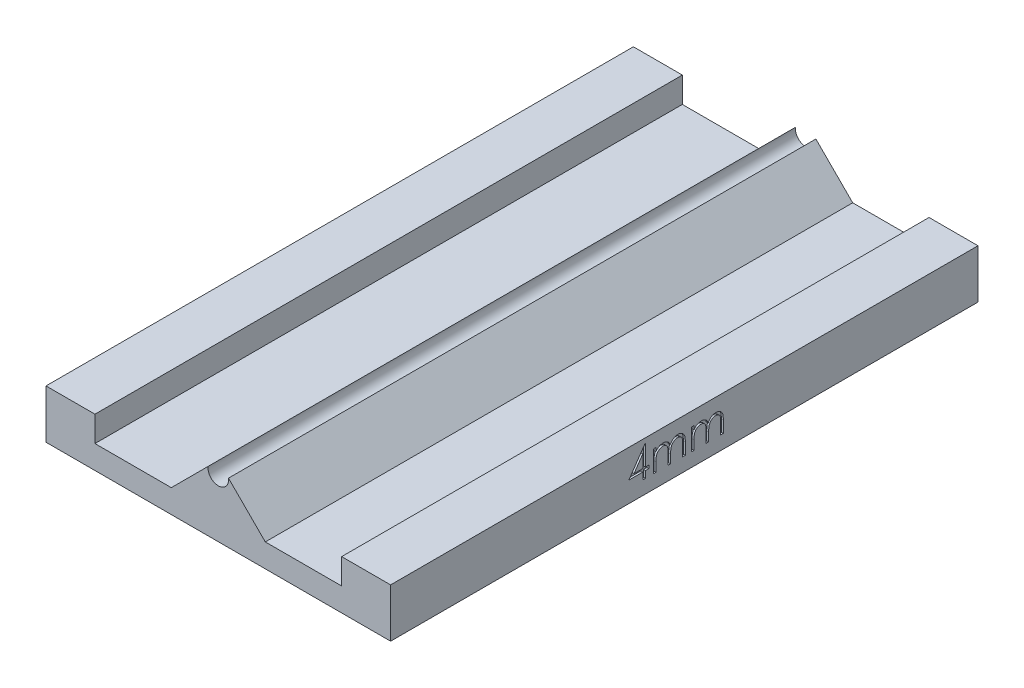
from build123d import *

# Parameters (mm, degrees)
BOSS_EXTRUDE1_DEPTH = 120
CUT_EXTRUDE1_DEPTH  = 0.4


with BuildPart() as part:
    # Sketch1 → Boss-Extrude1 (new body)
    with BuildSketch(Plane.XY):
        with BuildLine():
            ThreePointArc((2.1, 0), (-0.147755484, -2.094795531), (-2.079207921, 0.294778598))
            Line((-2.079207921, 0.294778598), (-9.604138038, -7.230151519))
            Line((-9.604138038, -7.230151519), (-25.2, -7.230151519))
            Line((-25.2, -7.230151519), (-25.2, -2.030151519))
            Line((-25.2, -2.030151519), (-35.2, -2.030151519))
            Line((-35.2, -2.030151519), (-35.2, -12))
            Line((-35.2, -12), (35.2, -12))
            Line((35.2, -12), (35.2, -2.030151519))
            Line((35.2, -2.030151519), (25.2, -2.030151519))
            Line((25.2, -2.030151519), (25.2, -7.230151519))
            Line((25.2, -7.230151519), (9.604138038, -7.230151519))
            Line((9.604138038, -7.230151519), (2.079207921, 0.294778598))
            ThreePointArc((2.079207921, 0.294778598), (2.094795531, 0.147755484), (2.1, 0))
        make_face()
    extrude(amount=BOSS_EXTRUDE1_DEPTH)

    # Sketch2 → Cut-Extrude1 (cut)
    # profile 1 of 3: a face of its own
    with BuildSketch(Plane(origin=(35.2, 0, 0), x_dir=(0, 0, -1), z_dir=(1, 0, 0))):
        Polygon((-68.056401288, -3.06394384), (-67.947026288, -3.06394384), (-67.947026288, -7.217789993), (-67.254718595, -7.217789993), (-67.254718595, -7.833174609), (-67.947026288, -7.833174609), (-67.947026288, -9.217789993), (-68.485487826, -9.217789993), (-68.485487826, -7.833174609), (-71.331641672, -7.833174609), align=None)
        Polygon((-68.485487826, -7.217789993), (-68.485487826, -4.614424609), (-70.272747441, -7.217789993), align=None, mode=Mode.SUBTRACT)
    # profile 2 of 3: a face of its own
    with BuildSketch(Plane(origin=(35.2, 0, 0), x_dir=(0, 0, -1), z_dir=(1, 0, 0))):
        with BuildLine():
            Line((-66.331641672, -4.833174609), (-65.793180134, -4.833174609))
            Line((-65.793180134, -4.833174609), (-65.793180134, -5.59519384))
            add(Edge.make_bspline(
                [(-65.793180134, -5.59519384), (-65.744693362, -5.528529379), (-65.65178806, -5.400793883), (-65.499446942, -5.232467681), (-65.34725932, -5.089619416), (-65.237659237, -5.014631636), (-65.185007057, -4.978607301)],
                knots=[0, 0, 0, 0, 1.134379233, 2.173579362, 3.122582517, 4, 4, 4, 4], degree=3))
            add(Edge.make_bspline(
                [(-65.185007057, -4.978607301), (-65.113239064, -4.944312389), (-64.970956951, -4.876321738), (-64.745666851, -4.807349922), (-64.515138846, -4.764964034), (-64.359467622, -4.759167394), (-64.281160903, -4.756251532)],
                knots=[0, 0, 0, 0, 1.014936303, 2.012140481, 3.000054389, 4, 4, 4, 4], degree=3))
            add(Edge.make_bspline(
                [(-64.281160903, -4.756251532), (-64.22820148, -4.758043459), (-64.12339763, -4.761589586), (-63.968110619, -4.784663932), (-63.817495856, -4.8245488), (-63.672443234, -4.880104213), (-63.535779212, -4.947384247), (-63.410483445, -5.026326604), (-63.297984802, -5.114950162), (-63.198340143, -5.217256904), (-63.108736099, -5.336119644), (-63.026315219, -5.474744071), (-62.950157712, -5.636242919), (-62.907949754, -5.753442703), (-62.885728211, -5.815145763)],
                knots=[0, 0, 0, 0, 1.009824226, 1.998387844, 2.986035974, 3.974953746, 4.955485308, 5.885931332, 6.793869504, 7.679848016, 8.601185859, 9.625726857, 10.749998409, 12, 12, 12, 12], degree=3))
            add(Edge.make_bspline(
                [(-62.885728211, -5.815145763), (-62.862223208, -5.772761044), (-62.815968665, -5.68935387), (-62.738301858, -5.571311134), (-62.656928493, -5.460899491), (-62.571155076, -5.358031335), (-62.481284356, -5.263214654), (-62.386893384, -5.176135966), (-62.288519473, -5.096421314), (-62.151732776, -5.003295898), (-61.973768306, -4.904379587), (-61.749388681, -4.81861654), (-61.515988387, -4.765617463), (-61.357558047, -4.759394138), (-61.277555134, -4.756251532)],
                knots=[0, 0, 0, 0, 0.86119277, 1.694706429, 2.50939023, 3.298075842, 4.073795165, 4.829715201, 5.57930267, 6.321991688, 7.768977793, 9.186738141, 10.579381044, 12, 12, 12, 12], degree=3))
            add(Edge.make_bspline(
                [(-61.277555134, -4.756251532), (-61.204044055, -4.75902391), (-61.060175735, -4.764449725), (-60.850728994, -4.807055679), (-60.655400185, -4.88021736), (-60.47458234, -4.980046451), (-60.311451231, -5.105496479), (-60.169651844, -5.254757344), (-60.050045507, -5.426773269), (-59.971910696, -5.588588107), (-59.9189131, -5.731448677), (-59.886236699, -5.853173748), (-59.85736865, -5.987147839), (-59.833400801, -6.133531144), (-59.815883283, -6.292840759), (-59.802904914, -6.464815974), (-59.794120788, -6.649590452), (-59.793500092, -6.777074166), (-59.793180134, -6.842789993)],
                knots=[0, 0, 0, 0, 1.209669288, 2.367440248, 3.500751976, 4.631527125, 5.755587489, 6.87532382, 8.007944318, 9.190864318, 9.82315674, 10.514484317, 11.263564316, 12.079023757, 12.955305781, 13.901327259, 14.918167583, 16, 16, 16, 16], degree=3))
            Line((-59.793180134, -6.842789993), (-59.793180134, -9.217789993))
            Line((-59.793180134, -9.217789993), (-60.331641672, -9.217789993))
            Line((-60.331641672, -9.217789993), (-60.331641672, -6.840386147))
            add(Edge.make_bspline(
                [(-60.331641672, -6.840386147), (-60.331775186, -6.784293735), (-60.332031779, -6.676492649), (-60.336649433, -6.521774161), (-60.345349971, -6.380742691), (-60.355523638, -6.25359054), (-60.369655882, -6.140021189), (-60.387906051, -6.040262757), (-60.407239217, -5.953530509), (-60.439358058, -5.857382999), (-60.490697301, -5.751319781), (-60.568898696, -5.636936508), (-60.667418878, -5.537369422), (-60.781179146, -5.450938021), (-60.910690766, -5.380663208), (-61.053430291, -5.330475763), (-61.208511522, -5.299407971), (-61.315864874, -5.296311945), (-61.371305134, -5.29471307)],
                knots=[0, 0, 0, 0, 1.253487763, 2.409012846, 3.458416907, 4.410876679, 5.259312806, 6.014470957, 6.676830364, 7.243083969, 8.276244668, 9.299465089, 10.325150304, 11.392391894, 12.482080715, 13.603491619, 14.762376348, 16, 16, 16, 16], degree=3))
            add(Edge.make_bspline(
                [(-61.371305134, -5.29471307), (-61.43931077, -5.297140769), (-61.57371576, -5.301938824), (-61.769908022, -5.350922606), (-61.958429765, -5.424774464), (-62.133655707, -5.531801533), (-62.294846206, -5.660044443), (-62.433531196, -5.812529464), (-62.548100657, -5.98503791), (-62.625678902, -6.144717972), (-62.674689132, -6.288151304), (-62.707049559, -6.413461084), (-62.732221088, -6.555886629), (-62.755827709, -6.714470899), (-62.771235243, -6.890305494), (-62.785238167, -7.082577039), (-62.791788217, -7.291863826), (-62.792704432, -7.43693815), (-62.793180134, -7.512261147)],
                knots=[0, 0, 0, 0, 1.090531906, 2.155305635, 3.229839962, 4.33261226, 5.44038871, 6.529323825, 7.629011124, 8.757537029, 9.370236727, 10.061839251, 10.834451254, 11.692844982, 12.636905849, 13.66920014, 14.789842145, 16, 16, 16, 16], degree=3))
            Line((-62.793180134, -7.512261147), (-62.793180134, -9.217789993))
            Line((-62.793180134, -9.217789993), (-63.331641672, -9.217789993))
            Line((-63.331641672, -9.217789993), (-63.331641672, -6.988222686))
            add(Edge.make_bspline(
                [(-63.331641672, -6.988222686), (-63.33177784, -6.925319854), (-63.332039812, -6.804301127), (-63.336627784, -6.630757684), (-63.345347707, -6.472904403), (-63.355428647, -6.330924751), (-63.369931811, -6.205076759), (-63.386405688, -6.094685745), (-63.405860449, -6.000028458), (-63.43807168, -5.896205512), (-63.487296483, -5.781826787), (-63.566476361, -5.659870751), (-63.665232213, -5.553125441), (-63.781068, -5.461996158), (-63.911363455, -5.386667904), (-64.055334999, -5.332394044), (-64.211686278, -5.300809547), (-64.319476631, -5.296783553), (-64.374910903, -5.29471307)],
                knots=[0, 0, 0, 0, 1.320475261, 2.540461679, 3.643808994, 4.639130445, 5.527981419, 6.302341397, 6.981980563, 7.553956391, 8.582137848, 9.585246428, 10.591171744, 11.620968678, 12.668337649, 13.738356861, 14.836885341, 16, 16, 16, 16], degree=3))
            add(Edge.make_bspline(
                [(-64.374910903, -5.29471307), (-64.440081551, -5.297336716), (-64.569964339, -5.302565549), (-64.760767715, -5.349630018), (-64.945028887, -5.423351289), (-65.119808371, -5.525625265), (-65.280392625, -5.6523094), (-65.420978226, -5.801306364), (-65.539165413, -5.97076185), (-65.61756281, -6.128758164), (-65.668131622, -6.268598064), (-65.701723625, -6.387485403), (-65.730591555, -6.519485828), (-65.752044163, -6.66500659), (-65.772753447, -6.823099894), (-65.782748263, -6.994553305), (-65.792470941, -7.179219741), (-65.792937937, -7.306715533), (-65.793180134, -7.37283807)],
                knots=[0, 0, 0, 0, 1.098833095, 2.189935336, 3.297829714, 4.440610912, 5.596351641, 6.740013378, 7.886572111, 9.072425424, 9.705826452, 10.395263256, 11.156850408, 11.985370555, 12.878090359, 13.847760091, 14.883794034, 16, 16, 16, 16], degree=3))
            Line((-65.793180134, -7.37283807), (-65.793180134, -9.217789993))
            Line((-65.793180134, -9.217789993), (-66.331641672, -9.217789993))
            Line((-66.331641672, -9.217789993), (-66.331641672, -4.833174609))
        make_face()
    # profile 3 of 3: a face of its own
    with BuildSketch(Plane(origin=(35.2, 0, 0), x_dir=(0, 0, -1), z_dir=(1, 0, 0))):
        with BuildLine():
            Line((-58.562410903, -4.833174609), (-58.023949364, -4.833174609))
            Line((-58.023949364, -4.833174609), (-58.023949364, -5.59519384))
            add(Edge.make_bspline(
                [(-58.023949364, -5.59519384), (-57.975462593, -5.528529379), (-57.882557291, -5.400793883), (-57.730216172, -5.232467681), (-57.578028551, -5.089619416), (-57.468428468, -5.014631636), (-57.415776288, -4.978607301)],
                knots=[0, 0, 0, 0, 1.134379233, 2.173579362, 3.122582517, 4, 4, 4, 4], degree=3))
            add(Edge.make_bspline(
                [(-57.415776288, -4.978607301), (-57.344008295, -4.944312389), (-57.201726181, -4.876321738), (-56.976436082, -4.807349922), (-56.745908077, -4.764964034), (-56.590236853, -4.759167394), (-56.511930134, -4.756251532)],
                knots=[0, 0, 0, 0, 1.014936303, 2.012140481, 3.000054389, 4, 4, 4, 4], degree=3))
            add(Edge.make_bspline(
                [(-56.511930134, -4.756251532), (-56.458970711, -4.758043459), (-56.354166861, -4.761589586), (-56.19887985, -4.784663932), (-56.048265086, -4.8245488), (-55.903212465, -4.880104213), (-55.766548443, -4.947384247), (-55.641252676, -5.026326604), (-55.528754033, -5.114950162), (-55.429109374, -5.217256904), (-55.33950533, -5.336119644), (-55.25708445, -5.474744071), (-55.180926943, -5.636242919), (-55.138718985, -5.753442703), (-55.116497441, -5.815145763)],
                knots=[0, 0, 0, 0, 1.009824226, 1.998387844, 2.986035974, 3.974953746, 4.955485308, 5.885931332, 6.793869504, 7.679848016, 8.601185859, 9.625726857, 10.749998409, 12, 12, 12, 12], degree=3))
            add(Edge.make_bspline(
                [(-55.116497441, -5.815145763), (-55.092992439, -5.772761044), (-55.046737895, -5.68935387), (-54.969071089, -5.571311134), (-54.887697724, -5.460899491), (-54.801924307, -5.358031335), (-54.712053587, -5.263214654), (-54.617662615, -5.176135966), (-54.519288704, -5.096421314), (-54.382502007, -5.003295898), (-54.204537537, -4.904379587), (-53.980157912, -4.81861654), (-53.746757618, -4.765617463), (-53.588327278, -4.759394138), (-53.508324364, -4.756251532)],
                knots=[0, 0, 0, 0, 0.86119277, 1.694706429, 2.50939023, 3.298075842, 4.073795165, 4.829715201, 5.57930267, 6.321991688, 7.768977793, 9.186738141, 10.579381044, 12, 12, 12, 12], degree=3))
            add(Edge.make_bspline(
                [(-53.508324364, -4.756251532), (-53.434813285, -4.75902391), (-53.290944966, -4.764449725), (-53.081498225, -4.807055679), (-52.886169416, -4.88021736), (-52.705351571, -4.980046451), (-52.542220462, -5.105496479), (-52.400421075, -5.254757344), (-52.280814738, -5.426773269), (-52.202679927, -5.588588107), (-52.149682331, -5.731448677), (-52.117005929, -5.853173748), (-52.088137881, -5.987147839), (-52.064170032, -6.133531144), (-52.046652514, -6.292840759), (-52.033674144, -6.464815974), (-52.024890018, -6.649590452), (-52.024269323, -6.777074166), (-52.023949364, -6.842789993)],
                knots=[0, 0, 0, 0, 1.209669288, 2.367440248, 3.500751976, 4.631527125, 5.755587489, 6.87532382, 8.007944318, 9.190864318, 9.82315674, 10.514484317, 11.263564316, 12.079023757, 12.955305781, 13.901327259, 14.918167583, 16, 16, 16, 16], degree=3))
            Line((-52.023949364, -6.842789993), (-52.023949364, -9.217789993))
            Line((-52.023949364, -9.217789993), (-52.562410903, -9.217789993))
            Line((-52.562410903, -9.217789993), (-52.562410903, -6.840386147))
            add(Edge.make_bspline(
                [(-52.562410903, -6.840386147), (-52.562544417, -6.784293735), (-52.56280101, -6.676492649), (-52.567418664, -6.521774161), (-52.576119202, -6.380742691), (-52.586292868, -6.25359054), (-52.600425113, -6.140021189), (-52.618675282, -6.040262757), (-52.638008447, -5.953530509), (-52.670127289, -5.857382999), (-52.721466532, -5.751319781), (-52.799667926, -5.636936508), (-52.898188109, -5.537369422), (-53.011948377, -5.450938021), (-53.141459996, -5.380663208), (-53.284199522, -5.330475763), (-53.439280753, -5.299407971), (-53.546634105, -5.296311945), (-53.602074364, -5.29471307)],
                knots=[0, 0, 0, 0, 1.253487763, 2.409012846, 3.458416907, 4.410876679, 5.259312806, 6.014470957, 6.676830364, 7.243083969, 8.276244668, 9.299465089, 10.325150304, 11.392391894, 12.482080715, 13.603491619, 14.762376348, 16, 16, 16, 16], degree=3))
            add(Edge.make_bspline(
                [(-53.602074364, -5.29471307), (-53.67008, -5.297140769), (-53.804484991, -5.301938824), (-54.000677253, -5.350922606), (-54.189198996, -5.424774464), (-54.364424938, -5.531801533), (-54.525615436, -5.660044443), (-54.664300427, -5.812529464), (-54.778869888, -5.98503791), (-54.856448132, -6.144717972), (-54.905458363, -6.288151304), (-54.93781879, -6.413461084), (-54.962990318, -6.555886629), (-54.98659694, -6.714470899), (-55.002004473, -6.890305494), (-55.016007397, -7.082577039), (-55.022557448, -7.291863826), (-55.023473663, -7.43693815), (-55.023949364, -7.512261147)],
                knots=[0, 0, 0, 0, 1.090531906, 2.155305635, 3.229839962, 4.33261226, 5.44038871, 6.529323825, 7.629011124, 8.757537029, 9.370236727, 10.061839251, 10.834451254, 11.692844982, 12.636905849, 13.66920014, 14.789842145, 16, 16, 16, 16], degree=3))
            Line((-55.023949364, -7.512261147), (-55.023949364, -9.217789993))
            Line((-55.023949364, -9.217789993), (-55.562410903, -9.217789993))
            Line((-55.562410903, -9.217789993), (-55.562410903, -6.988222686))
            add(Edge.make_bspline(
                [(-55.562410903, -6.988222686), (-55.56254707, -6.925319854), (-55.562809043, -6.804301127), (-55.567397015, -6.630757684), (-55.576116938, -6.472904403), (-55.586197878, -6.330924751), (-55.600701041, -6.205076759), (-55.617174919, -6.094685745), (-55.63662968, -6.000028458), (-55.668840911, -5.896205512), (-55.718065714, -5.781826787), (-55.797245591, -5.659870751), (-55.896001443, -5.553125441), (-56.011837231, -5.461996158), (-56.142132686, -5.386667904), (-56.28610423, -5.332394044), (-56.442455509, -5.300809547), (-56.550245862, -5.296783553), (-56.605680134, -5.29471307)],
                knots=[0, 0, 0, 0, 1.320475261, 2.540461679, 3.643808994, 4.639130445, 5.527981419, 6.302341397, 6.981980563, 7.553956391, 8.582137848, 9.585246428, 10.591171744, 11.620968678, 12.668337649, 13.738356861, 14.836885341, 16, 16, 16, 16], degree=3))
            add(Edge.make_bspline(
                [(-56.605680134, -5.29471307), (-56.670850782, -5.297336716), (-56.800733569, -5.302565549), (-56.991536946, -5.349630018), (-57.175798118, -5.423351289), (-57.350577602, -5.525625265), (-57.511161856, -5.6523094), (-57.651747457, -5.801306364), (-57.769934643, -5.97076185), (-57.84833204, -6.128758164), (-57.898900853, -6.268598064), (-57.932492856, -6.387485403), (-57.961360785, -6.519485828), (-57.982813394, -6.66500659), (-58.003522678, -6.823099894), (-58.013517494, -6.994553305), (-58.023240172, -7.179219741), (-58.023707168, -7.306715533), (-58.023949364, -7.37283807)],
                knots=[0, 0, 0, 0, 1.098833095, 2.189935336, 3.297829714, 4.440610912, 5.596351641, 6.740013378, 7.886572111, 9.072425424, 9.705826452, 10.395263256, 11.156850408, 11.985370555, 12.878090359, 13.847760091, 14.883794034, 16, 16, 16, 16], degree=3))
            Line((-58.023949364, -7.37283807), (-58.023949364, -9.217789993))
            Line((-58.023949364, -9.217789993), (-58.562410903, -9.217789993))
            Line((-58.562410903, -9.217789993), (-58.562410903, -4.833174609))
        make_face()
    extrude(amount=-CUT_EXTRUDE1_DEPTH, mode=Mode.SUBTRACT)


solid = part.part
